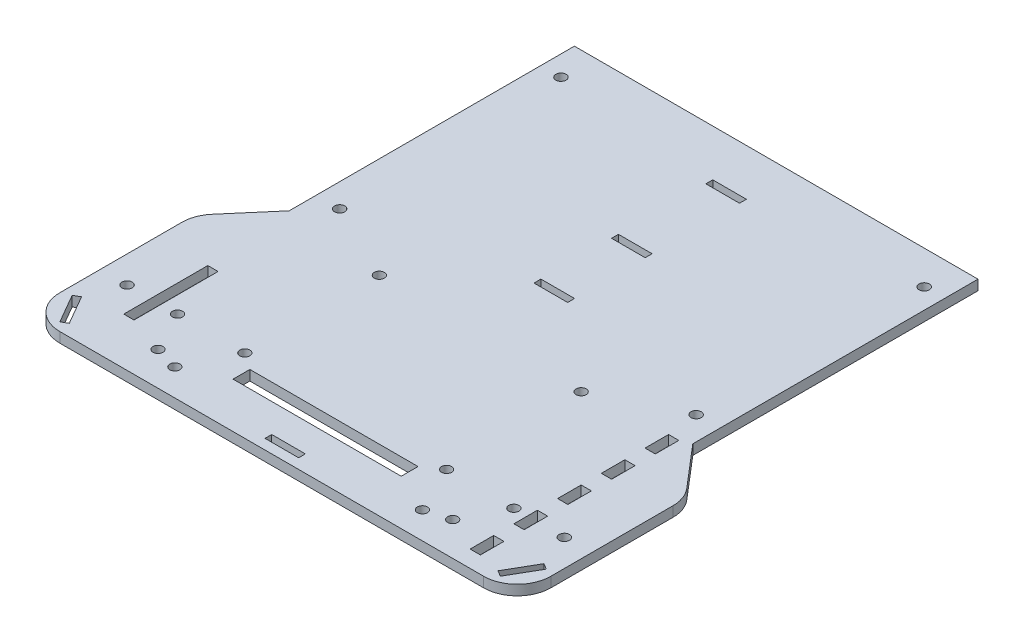
from build123d import *

# Parameters (mm, degrees)
BOSS_EXTRUDE1_DEPTH = 3
SKETCH2_R           = 1.525
CUT_EXTRUDE1_DEPTH  = 105.70434566
SKETCH3_W           = 10
SKETCH3_H           = 2.05
CUT_EXTRUDE2_DEPTH  = 105.70434566
SKETCH4_R           = 1.5
CUT_EXTRUDE3_DEPTH  = 3
SKETCH5_R           = 1.5
SKETCH5_R_2         = 1.525
SKETCH5_W           = 50
SKETCH5_H           = 5
CUT_EXTRUDE4_DEPTH  = 3
SKETCH6_W           = 3.05
SKETCH6_H           = 7
CUT_EXTRUDE5_DEPTH  = 10
SKETCH7_W           = 10
SKETCH7_H           = 2
SKETCH7_W_2         = 3.05
SKETCH7_H_2         = 25
CUT_EXTRUDE6_DEPTH  = 10
FILLET3_R           = 10
CUT_EXTRUDE7_DEPTH  = 10
SKETCH9_R           = 1.5
CUT_EXTRUDE8_DEPTH  = 3


with BuildPart() as part:
    # Sketch1 → Boss-Extrude1 (new body)
    with BuildSketch(Plane(origin=(0, 0, 0), x_dir=(1, 0, 0), z_dir=(0, 1, 0))):
        Polygon((-73, -25), (-60, -9.801315846), (-60, 75), (60, 75), (60, -9.801315846), (73, -25), (73, -75), (60, -75), (-60, -75), (-73, -75), align=None)
    extrude(amount=BOSS_EXTRUDE1_DEPTH)

    # Sketch2 → Cut-Extrude1 (cut, through all)
    with BuildSketch(Plane(origin=(0, 3, 0), x_dir=(1, 0, 0), z_dir=(0, 1, 0))):
        with Locations(Location((-53, -1.81, 0), (0, 0, 270))):
            Circle(SKETCH2_R)
        with Locations(Location((-54, 65, 0), (0, 0, 270))):
            Circle(SKETCH2_R)
        with Locations(Location((53, -1.81, 0), (0, 0, 90))):
            Circle(SKETCH2_R)
        with Locations(Location((54, 65, 0), (0, 0, 90))):
            Circle(SKETCH2_R)
    extrude(amount=-CUT_EXTRUDE1_DEPTH, mode=Mode.SUBTRACT)

    # Sketch3 → Cut-Extrude2 (cut, through all)
    with BuildSketch(Plane(origin=(0, 3, 0), x_dir=(1, 0, 0), z_dir=(0, 1, 0))):
        with Locations((0, 32.065)):
            Rectangle(SKETCH3_W, SKETCH3_H)
        with Locations((0, 9.015)):
            Rectangle(SKETCH3_W, SKETCH3_H)
        with Locations((0, 60.115)):
            Rectangle(SKETCH3_W, SKETCH3_H)
    extrude(amount=-CUT_EXTRUDE2_DEPTH, mode=Mode.SUBTRACT)

    # Sketch4 → Cut-Extrude3 (cut)
    with BuildSketch(Plane(origin=(0, 3, 0), x_dir=(1, 0, 0), z_dir=(0, 1, 0))):
        with Locations(Location((-50, -53, 0), (0, 0, 270))):
            Circle(SKETCH4_R)
        with Locations(Location((-43.815341562, -65, 0), (0, 0, 270))):
            Circle(SKETCH4_R)
        with Locations(Location((43.815341562, -65, 0), (0, 0, 90))):
            Circle(SKETCH4_R)
        with Locations(Location((50, -53, 0), (0, 0, 90))):
            Circle(SKETCH4_R)
    extrude(amount=-CUT_EXTRUDE3_DEPTH, mode=Mode.SUBTRACT)

    # Sketch5 → Cut-Extrude4 (cut)
    with BuildSketch(Plane(origin=(0, 3, 0), x_dir=(1, 0, 0), z_dir=(0, 1, 0))):
        with Locations(Location((-36.8, -67, 0), (0, 0, 270))):
            Circle(SKETCH5_R)
        with Locations(Location((36.8, -67, 0), (0, 0, 90))):
            Circle(SKETCH5_R)
        with Locations(Location((-65, -53, 0), (0, 0, 270))):
            Circle(SKETCH5_R_2)
        with Locations(Location((65, -53, 0), (0, 0, 90))):
            Circle(SKETCH5_R_2)
        with Locations((0, -59)):
            Rectangle(SKETCH5_W, SKETCH5_H)
    extrude(amount=-CUT_EXTRUDE4_DEPTH, mode=Mode.SUBTRACT)

    # Sketch6 → Cut-Extrude5 (cut)
    with BuildSketch(Plane(origin=(0, 3, 0), x_dir=(1, 0, 0), z_dir=(0, 1, 0))):
        with Locations((55.525, -53.5)):
            Rectangle(SKETCH6_W, SKETCH6_H)
        with Locations((55.525, -66.5)):
            Rectangle(SKETCH6_W, SKETCH6_H)
        with Locations((55.525, -40.5)):
            Rectangle(SKETCH6_W, SKETCH6_H)
        with Locations((55.525, -27.5)):
            Rectangle(SKETCH6_W, SKETCH6_H)
        with Locations((55.525, -14.5)):
            Rectangle(SKETCH6_W, SKETCH6_H)
    extrude(amount=-CUT_EXTRUDE5_DEPTH, mode=Mode.SUBTRACT)

    # Sketch7 → Cut-Extrude6 (cut)
    with BuildSketch(Plane(origin=(0, 3, 0), x_dir=(1, 0, 0), z_dir=(0, 1, 0))):
        with Locations((0, -71)):
            Rectangle(SKETCH7_W, SKETCH7_H)
        with Locations((-56.475, -48.5)):
            Rectangle(SKETCH7_W_2, SKETCH7_H_2)
    extrude(amount=-CUT_EXTRUDE6_DEPTH, mode=Mode.SUBTRACT)

    # Fillet3
    fillet3_edges = [part.edges().sort_by_distance(p)[0] for p in [
        (73, 1.5, 25),
        (73, 1.5, 75),
        (-73, 1.5, 75),
        (-73, 1.5, 25),
    ]]
    fillet(fillet3_edges, radius=FILLET3_R)

    # Sketch8 → Cut-Extrude7 (cut)
    with BuildSketch(Plane(origin=(0, 3, 0), x_dir=(1, 0, 0), z_dir=(0, 1, 0))):
        Polygon((70.5, -63.839745962), (65.5, -72.5), (63.724647922, -71.475), (68.724647922, -62.814745962), align=None)
        Polygon((-68.724647922, -62.814745962), (-70.5, -63.839745962), (-65.5, -72.5), (-63.724647922, -71.475), align=None)
    extrude(amount=-CUT_EXTRUDE7_DEPTH, mode=Mode.SUBTRACT)

    # Sketch9 → Cut-Extrude8 (cut)
    with BuildSketch(Plane(origin=(0, 3, 0), x_dir=(1, 0, 0), z_dir=(0, 1, 0))):
        with Locations(Location((-30, -13, 0), (0, 0, 270))):
            Circle(SKETCH9_R)
        with Locations(Location((30, -13, 0), (0, 0, 90))):
            Circle(SKETCH9_R)
        with Locations(Location((30, -53, 0), (0, 0, 270))):
            Circle(SKETCH9_R)
        with Locations(Location((-30, -53, 0), (0, 0, 90))):
            Circle(SKETCH9_R)
    extrude(amount=-CUT_EXTRUDE8_DEPTH, mode=Mode.SUBTRACT)


solid = part.part
